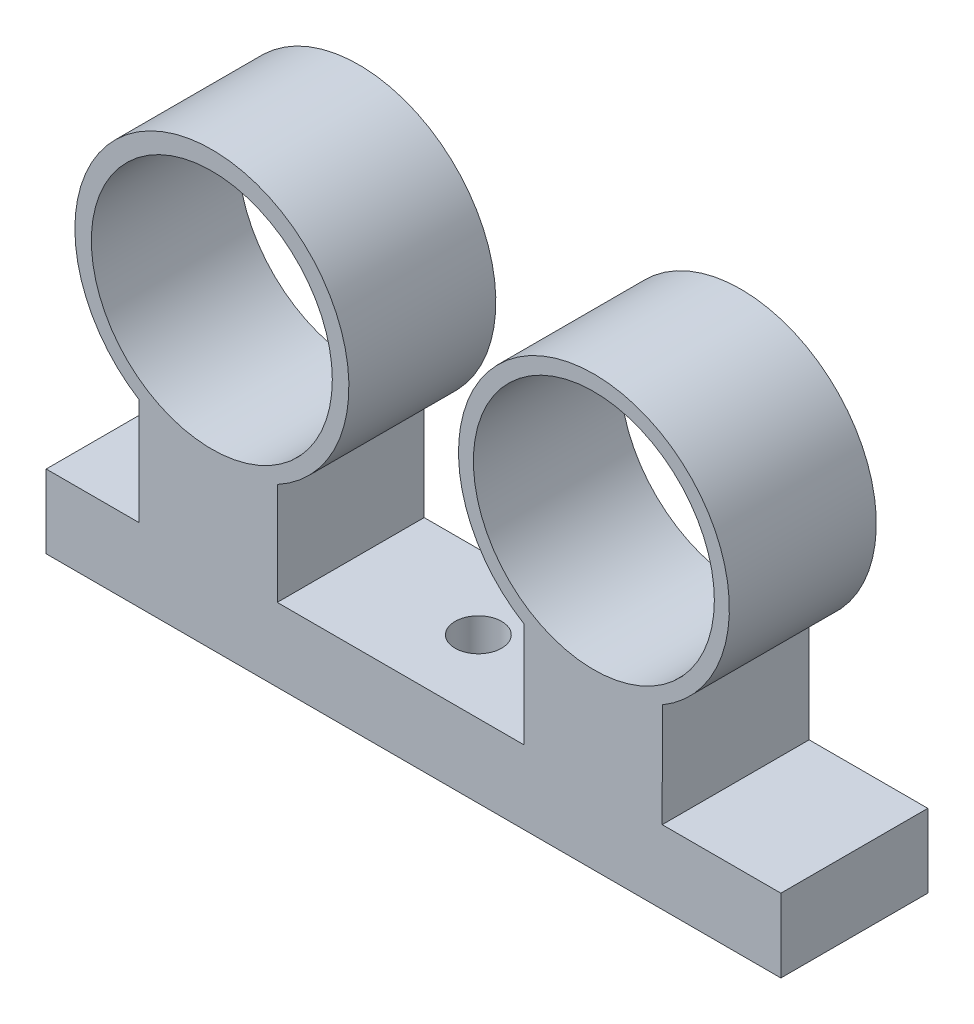
from build123d import *

# Parameters (mm, degrees)
SKETCH1_R           = 8.2
BOSS_EXTRUDE1_DEPTH = 10
SKETCH2_R           = 1.585
CUT_EXTRUDE1_DEPTH  = 10


with BuildPart() as part:
    # Sketch1 → Boss-Extrude1 (new body)
    with BuildSketch(Plane.XY):
        with BuildLine():
            Line((-4.18853286, 12.607697881), (-4.18853286, 5.367776119))
            Line((-4.18853286, 5.367776119), (-10.519480519, 5.367776119))
            Line((-10.519480519, 5.367776119), (-10.519480519, 0.367776119))
            Line((-10.519480519, 0.367776119), (39.480519481, 0.367776119))
            Line((39.480519481, 0.367776119), (39.480519481, 5.367776119))
            Line((39.480519481, 5.367776119), (31.405454323, 5.367776119))
            Line((31.405454323, 5.367776119), (31.410877884, 12.433894833))
            ThreePointArc((31.410877884, 12.433894833), (26.812708154, 29.608501659), (22.010917954, 12.489708029))
            Line((22.010917954, 12.489708029), (22.005451554, 5.367776119))
            Line((22.005451554, 5.367776119), (5.205765597, 5.367776119))
            Line((5.205765597, 5.367776119), (5.205765597, 12.316995042))
            ThreePointArc((5.205765597, 12.316995042), (1.04612148, 29.83226088), (-4.18853286, 12.607697881))
        make_face()
        with Locations((26.753246753, 20.367776119)):
            Circle(SKETCH1_R, mode=Mode.SUBTRACT)
        with Locations((0.753246753, 20.367776119)):
            Circle(SKETCH1_R, mode=Mode.SUBTRACT)
    extrude(amount=BOSS_EXTRUDE1_DEPTH)

    # Sketch2 → Cut-Extrude1 (cut)
    with BuildSketch(Plane(origin=(0, 5.367776119, 0), x_dir=(1, 0, 0), z_dir=(0, 1, 0))):
        with Locations(Location((13.958626021, -5.067111952, 0), (0, 0, 270))):
            Circle(SKETCH2_R)
    extrude(amount=-CUT_EXTRUDE1_DEPTH, mode=Mode.SUBTRACT)


solid = part.part
